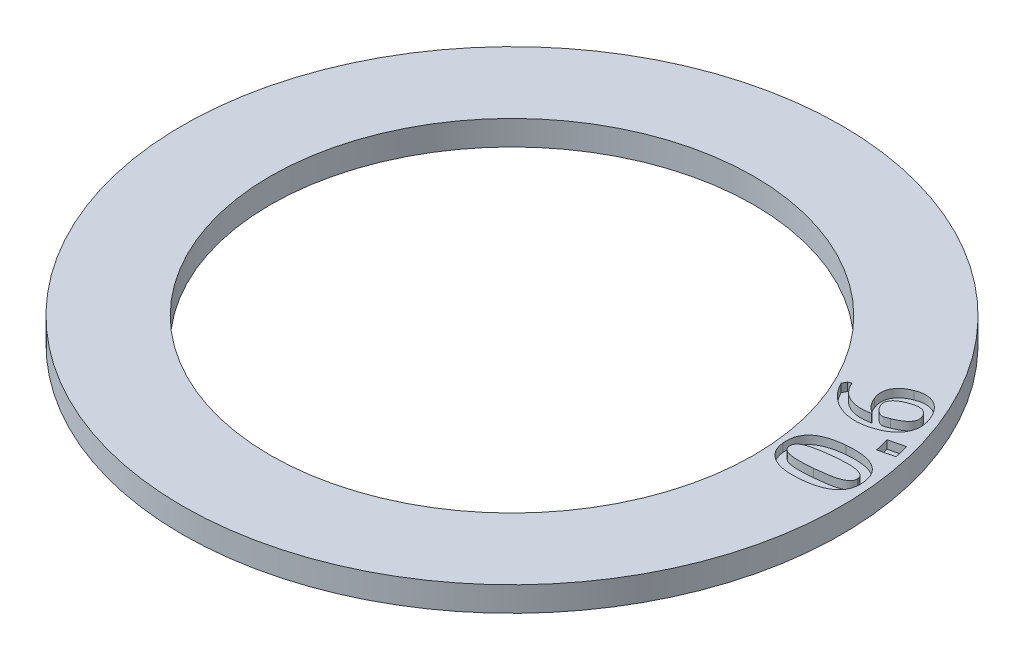
from build123d import *

# Parameters (mm, degrees)
SKETCH1_R           = 8.001
BOSS_EXTRUDE1_DEPTH = 0.6
SKETCH2_R           = 5.8674
CUT_EXTRUDE1_DEPTH  = 12.33101946
CUT_EXTRUDE2_DEPTH  = 0.2


with BuildPart() as part:
    # Sketch1 → Boss-Extrude1 (new body)
    with BuildSketch(Plane(origin=(0, 0, 0), x_dir=(1, 0, 0), z_dir=(0, 1, 0))):
        with Locations(Location((0, 0, 0), (0, 0, 270))):
            Circle(SKETCH1_R)
    extrude(amount=BOSS_EXTRUDE1_DEPTH)

    # Sketch2 → Cut-Extrude1 (cut, through all)
    with BuildSketch(Plane(origin=(0, 0, 0), x_dir=(-1, 0, 0), z_dir=(0, -1, 0))):
        with Locations(Location((0, 0, 0), (0, 0, 90))):
            Circle(SKETCH2_R)
    extrude(amount=-CUT_EXTRUDE1_DEPTH, mode=Mode.SUBTRACT)

    # Sketch4 → Cut-Extrude2 (cut)
    # profile 1 of 3: a face of its own
    with BuildSketch(Plane(origin=(0, 0.6, 0), x_dir=(1, 0, 0), z_dir=(0, 1, 0))):
        with BuildLine():
            add(Edge.make_bspline(
                [(7.767246669, 0.768228733), (7.768616681, 0.751777921), (7.771299992, 0.719557319), (7.771651226, 0.671847724), (7.768847829, 0.625994497), (7.763791281, 0.581665493), (7.754525531, 0.539395414), (7.743704494, 0.498411153), (7.728767986, 0.459603516), (7.711597242, 0.422178612), (7.690346507, 0.38684131), (7.666177088, 0.352853357), (7.638236216, 0.320709452), (7.606549541, 0.290467202), (7.571549975, 0.261408498), (7.532380513, 0.234700263), (7.490118852, 0.208976421), (7.444215831, 0.185169051), (7.394617995, 0.163124569), (7.341151112, 0.143032403), (7.283774168, 0.125099553), (7.22262746, 0.108861729), (7.15773129, 0.094649482), (7.088990392, 0.082380601), (7.016411757, 0.071901926), (6.966626953, 0.066709436), (6.941140332, 0.064051215)],
                knots=[0, 0, 0, 0, 0.959744186, 1.879757445, 2.771360733, 3.630433483, 4.470974874, 5.285729423, 6.092861057, 6.885868194, 7.677321799, 8.486806591, 9.30863703, 10.149710703, 11.031725224, 11.950856355, 12.90393232, 13.90755666, 14.955572763, 16.058595042, 17.227175211, 18.449982035, 19.736657795, 21.08935819, 22.509938377, 24, 24, 24, 24], degree=3))
            add(Edge.make_bspline(
                [(6.941140332, 0.064051215), (6.916974995, 0.061880059), (6.869600459, 0.057623652), (6.799552695, 0.05546182), (6.732246619, 0.054095152), (6.667515752, 0.056808837), (6.605390434, 0.060933713), (6.545892766, 0.069167948), (6.488793375, 0.078192436), (6.434684358, 0.091290062), (6.383159339, 0.106087129), (6.334547992, 0.124016841), (6.288435008, 0.14379007), (6.245679424, 0.166919217), (6.205071209, 0.191290458), (6.168116215, 0.219405569), (6.133618735, 0.249507551), (6.101916714, 0.281940861), (6.073178989, 0.316655739), (6.048138911, 0.354096013), (6.025624552, 0.393275429), (6.006775454, 0.434830179), (5.990860649, 0.478280184), (5.97804857, 0.523914814), (5.968933769, 0.571851451), (5.965003292, 0.604601182), (5.963008821, 0.621219618)],
                knots=[0, 0, 0, 0, 1.373964495, 2.693565985, 3.968553968, 5.185962309, 6.362128109, 7.493465967, 8.586945452, 9.634820339, 10.644545933, 11.621736809, 12.567827687, 13.483617295, 14.373243629, 15.247464012, 16.109610849, 16.964804151, 17.813643683, 18.658252232, 19.51307309, 20.370435758, 21.2393278, 22.1319618, 23.052087694, 24, 24, 24, 24], degree=3))
            add(Edge.make_bspline(
                [(5.963008821, 0.621219618), (5.961184373, 0.646930902), (5.95763602, 0.696936533), (5.96137283, 0.770131508), (5.971504627, 0.839027769), (5.989228129, 0.903508083), (6.014520014, 0.96357217), (6.04714147, 1.019062788), (6.086958764, 1.070172135), (6.134139349, 1.116694144), (6.188721214, 1.159142499), (6.251133852, 1.196622046), (6.320892733, 1.230357684), (6.39805777, 1.259957356), (6.483198664, 1.284783723), (6.575549001, 1.305930912), (6.675709611, 1.322447947), (6.745085036, 1.329983457), (6.781012294, 1.333885851)],
                knots=[0, 0, 0, 0, 0.999181933, 1.943299396, 2.836688392, 3.696188225, 4.530240668, 5.35776012, 6.186181664, 7.036493394, 7.921805995, 8.862264049, 9.85532249, 10.92466266, 12.06451709, 13.293082439, 14.598176172, 16, 16, 16, 16], degree=3))
            add(Edge.make_bspline(
                [(6.781012294, 1.333885851), (6.81803141, 1.33685429), (6.8896785, 1.34259943), (6.994289887, 1.344482115), (7.09247788, 1.340834394), (7.184314819, 1.331440489), (7.269728355, 1.316028511), (7.348801983, 1.295144467), (7.421216007, 1.267592042), (7.487377583, 1.234868523), (7.546865181, 1.196208576), (7.599372849, 1.151568024), (7.644857911, 1.101265586), (7.683986055, 1.045789028), (7.715146063, 0.984112878), (7.739851728, 0.917186349), (7.758380239, 0.84479307), (7.764241211, 0.794181785), (7.767246669, 0.768228733)],
                knots=[0, 0, 0, 0, 1.381791394, 2.674330027, 3.891007168, 5.036428095, 6.106690612, 7.117972597, 8.075364145, 8.985087285, 9.859944246, 10.708764313, 11.542333244, 12.37753583, 13.227367402, 14.105765436, 15.028652003, 16, 16, 16, 16], degree=3))
        make_face()
        with BuildLine():
            add(Edge.make_bspline(
                [(6.866671148, 0.452602865), (6.889697586, 0.454875299), (6.934491251, 0.4592959), (6.999872995, 0.466462648), (7.061538367, 0.47487975), (7.1196573, 0.482517183), (7.173836485, 0.491793094), (7.224500186, 0.500320864), (7.271415228, 0.510077719), (7.314968307, 0.519989326), (7.355047115, 0.530925535), (7.392230977, 0.54188216), (7.426327762, 0.554128369), (7.45792115, 0.566154622), (7.486549911, 0.579270405), (7.512216891, 0.59318471), (7.534954055, 0.607890264), (7.561267422, 0.627278523), (7.588091481, 0.654296895), (7.610574076, 0.691529303), (7.622579768, 0.732786526), (7.621540687, 0.76108619), (7.621009255, 0.775559896)],
                knots=[0, 0, 0, 0, 1.559939649, 3.034573339, 4.433834629, 5.755759396, 6.985974602, 8.139252337, 9.219098498, 10.216076828, 11.149973839, 12.019543174, 12.828554085, 13.591800542, 14.297942877, 14.949827997, 15.558345547, 16.121961591, 17.152098737, 18.100852136, 19.028691373, 20, 20, 20, 20], degree=3))
            add(Edge.make_bspline(
                [(7.621009255, 0.775559896), (7.619926587, 0.783444862), (7.617802115, 0.798917181), (7.611247364, 0.820913825), (7.601815494, 0.841113003), (7.589289355, 0.85946844), (7.573504688, 0.876151112), (7.554876253, 0.891806256), (7.532589397, 0.905483149), (7.507224363, 0.918389587), (7.478179436, 0.929907602), (7.445133323, 0.939893447), (7.407985388, 0.948278178), (7.366622767, 0.955112177), (7.320673845, 0.960565141), (7.26993871, 0.963996795), (7.214067393, 0.964849171), (7.153475824, 0.96443608), (7.088620395, 0.962639875), (7.020087861, 0.958426726), (6.948029164, 0.953644299), (6.898817126, 0.949169218), (6.87361646, 0.946877604)],
                knots=[0, 0, 0, 0, 0.573306212, 1.12497326, 1.647738541, 2.175091007, 2.719775143, 3.2992746, 3.924540973, 4.60063781, 5.349821626, 6.17422386, 7.087672211, 8.09400518, 9.19609116, 10.423188986, 11.759030231, 13.224456304, 14.792560164, 16.436793354, 18.175341204, 20, 20, 20, 20], degree=3))
            add(Edge.make_bspline(
                [(6.87361646, 0.946877604), (6.836687451, 0.943168116), (6.765837033, 0.936051252), (6.6642894, 0.923461037), (6.572167603, 0.909249697), (6.489397948, 0.893929398), (6.415975648, 0.877516996), (6.351671393, 0.859878624), (6.296531315, 0.841328265), (6.250231831, 0.821497208), (6.211722069, 0.800868735), (6.179827667, 0.779476626), (6.154312053, 0.756843646), (6.134327243, 0.733560472), (6.120632252, 0.708587263), (6.111522689, 0.682666394), (6.107088612, 0.655184126), (6.108005916, 0.636534703), (6.108474533, 0.627007378)],
                knots=[0, 0, 0, 0, 1.987774042, 3.813658246, 5.479624312, 6.979295976, 8.321212524, 9.507797241, 10.549079436, 11.434594746, 12.202068828, 12.886080949, 13.486172645, 14.024182533, 14.520633445, 15.002090577, 15.490203663, 16, 16, 16, 16], degree=3))
            add(Edge.make_bspline(
                [(6.108474533, 0.627007378), (6.109977202, 0.616105411), (6.112912381, 0.594810466), (6.124504195, 0.564901982), (6.141393458, 0.538156965), (6.163940725, 0.514563755), (6.192219175, 0.494509046), (6.225899733, 0.477658199), (6.264821299, 0.46332312), (6.309515168, 0.452424457), (6.359718904, 0.44419951), (6.415351194, 0.438023841), (6.476531013, 0.434692049), (6.543336384, 0.434110018), (6.615897868, 0.435798603), (6.694364654, 0.439369725), (6.778648309, 0.444614762), (6.836714922, 0.449884327), (6.866671148, 0.452602865)],
                knots=[0, 0, 0, 0, 0.622531695, 1.215998619, 1.802972471, 2.4067536, 3.054715399, 3.759494987, 4.537400922, 5.402670149, 6.364594255, 7.421637757, 8.576224243, 9.838461732, 11.210360544, 12.692839009, 14.293854979, 16, 16, 16, 16], degree=3))
        make_face(mode=Mode.SUBTRACT)
    # profile 2 of 3: a face of its own
    with BuildSketch(Plane(origin=(0, 0.6, 0), x_dir=(1, 0, 0), z_dir=(0, 1, 0))):
        Polygon((7.162360941, 1.945434774), (7.54473898, 2.039196493), (7.62846858, 1.69849033), (7.246090542, 1.604728611), align=None)
    # profile 3 of 3: a face of its own
    with BuildSketch(Plane(origin=(0, 0.6, 0), x_dir=(1, 0, 0), z_dir=(0, 1, 0))):
        with BuildLine():
            Line((5.469586331, 2.679067715), (5.544441366, 2.709164069))
            add(Edge.make_bspline(
                [(5.544441366, 2.709164069), (5.553997437, 2.688026155), (5.57271904, 2.646614199), (5.606167014, 2.588592367), (5.642814457, 2.535425732), (5.683122205, 2.487380335), (5.726749434, 2.444088965), (5.774653894, 2.406794612), (5.825317941, 2.37360927), (5.879587149, 2.345906768), (5.936871534, 2.322937923), (5.997312638, 2.30574494), (6.060554964, 2.293371391), (6.126627308, 2.286027104), (6.195527294, 2.284304113), (6.267185278, 2.28753626), (6.341706905, 2.295527879), (6.391948354, 2.30472372), (6.417621487, 2.309422749)],
                knots=[0, 0, 0, 0, 1.056358198, 2.069544787, 3.046463473, 3.994810355, 4.922992523, 5.840907532, 6.755975124, 7.67847983, 8.612102683, 9.563504181, 10.536884028, 11.545076423, 12.588532476, 13.673608831, 14.811225531, 16, 16, 16, 16], degree=3))
            Line((6.417621487, 2.309422749), (6.418007338, 2.323313374))
            add(Edge.make_bspline(
                [(6.418007338, 2.323313374), (6.401355529, 2.334631587), (6.368597807, 2.35689697), (6.323634535, 2.394045133), (6.282807557, 2.432896767), (6.245644899, 2.473597232), (6.212557562, 2.51772228), (6.183001039, 2.56541758), (6.155666828, 2.616491824), (6.140307212, 2.652572924), (6.132477824, 2.67096485)],
                knots=[0, 0, 0, 0, 1.055747646, 2.076884814, 3.055218345, 4.010598299, 4.964643125, 5.943744131, 6.951847215, 8, 8, 8, 8], degree=3))
            add(Edge.make_bspline(
                [(6.132477824, 2.67096485), (6.124144285, 2.693542686), (6.107940409, 2.737443416), (6.094488788, 2.804658259), (6.090399573, 2.869977809), (6.095698921, 2.933219735), (6.110473661, 2.993848126), (6.134162603, 3.051201513), (6.16720264, 3.104558434), (6.208469463, 3.154168147), (6.257665276, 3.199583358), (6.314070539, 3.240569597), (6.377451954, 3.277200054), (6.423313951, 3.297019764), (6.44694614, 3.307232645)],
                knots=[0, 0, 0, 0, 1.077155339, 2.094439236, 3.058665492, 4.001572549, 4.926966633, 5.844248602, 6.77044999, 7.728299098, 8.727445613, 9.762645402, 10.84711545, 12, 12, 12, 12], degree=3))
            add(Edge.make_bspline(
                [(6.44694614, 3.307232645), (6.473236176, 3.316913762), (6.524481937, 3.335784645), (6.60329955, 3.35217586), (6.68053309, 3.359268693), (6.744027272, 3.35567564), (6.793453122, 3.347421792), (6.829915938, 3.338655382), (6.86541622, 3.326474087), (6.900467983, 3.311974761), (6.93427802, 3.293545595), (6.96769255, 3.272764426), (6.999992534, 3.248650775), (7.03180405, 3.222110008), (7.062183409, 3.192269), (7.091526882, 3.159777486), (7.119852526, 3.124645406), (7.14635736, 3.086373409), (7.171510158, 3.045228596), (7.195374834, 3.001333961), (7.217765588, 2.954520291), (7.231387248, 2.922084415), (7.238325914, 2.905562072)],
                knots=[0, 0, 0, 0, 1.667556463, 3.25047863, 4.781272758, 6.278229574, 7.024172525, 7.765890255, 8.509980223, 9.258752894, 10.023401272, 10.801717744, 11.60191677, 12.423308393, 13.268840413, 14.13706473, 15.031221836, 15.956122909, 16.909146299, 17.903763151, 18.93220877, 20, 20, 20, 20], degree=3))
            add(Edge.make_bspline(
                [(7.238325914, 2.905562072), (7.2443027, 2.890195718), (7.256091154, 2.85988753), (7.270206202, 2.814079535), (7.281447749, 2.768983073), (7.290206517, 2.724734428), (7.295035445, 2.680969441), (7.297366888, 2.637949102), (7.297303475, 2.59562517), (7.293087891, 2.554150621), (7.286909194, 2.51353294), (7.276525462, 2.474053444), (7.263865247, 2.435486591), (7.248514728, 2.397763276), (7.229434766, 2.361476988), (7.207358901, 2.32636834), (7.182490078, 2.292198488), (7.154841885, 2.259129557), (7.124091062, 2.227362722), (7.09069323, 2.196764846), (7.053745523, 2.168499399), (7.014632721, 2.140855319), (6.972678054, 2.11451325), (6.92727904, 2.090508071), (6.879547835, 2.067119037), (6.846252108, 2.053298895), (6.829324178, 2.046272576)],
                knots=[0, 0, 0, 0, 1.096611481, 2.162927238, 3.186037776, 4.187888433, 5.161159185, 6.112325853, 7.053588294, 7.973131817, 8.883271785, 9.783950666, 10.684995271, 11.582783765, 12.489821363, 13.408608175, 14.339664491, 15.299375374, 16.273661144, 17.279195558, 18.309579485, 19.365961692, 20.46524052, 21.602267724, 22.780965421, 24, 24, 24, 24], degree=3))
            add(Edge.make_bspline(
                [(6.829324178, 2.046272576), (6.80588988, 2.03723599), (6.759598052, 2.01938523), (6.689016712, 1.997912732), (6.618825108, 1.980512848), (6.548906421, 1.967215564), (6.479160521, 1.95877988), (6.409586295, 1.954530061), (6.340114182, 1.954388304), (6.27104884, 1.959161531), (6.202978844, 1.967880027), (6.136231824, 1.981133483), (6.071094525, 1.998378194), (6.007448873, 2.020161649), (5.945419807, 2.04611896), (5.884556954, 2.075616728), (5.825805484, 2.110414242), (5.76844495, 2.148723184), (5.713505797, 2.191118244), (5.661157094, 2.236700271), (5.612181483, 2.285817879), (5.56608196, 2.338158263), (5.522763256, 2.393724009), (5.482764379, 2.452874701), (5.445465095, 2.51500698), (5.423535077, 2.558410676), (5.412480428, 2.580289937)],
                knots=[0, 0, 0, 0, 1.077130003, 2.127749498, 3.16214838, 4.178257318, 5.178772943, 6.173750996, 7.16687633, 8.156701088, 9.141484692, 10.108834361, 11.073757893, 12.029902727, 12.99204604, 13.956843372, 14.928666993, 15.918737754, 16.914144044, 17.903415071, 18.894361722, 19.887272469, 20.893794336, 21.914506485, 22.948728778, 24, 24, 24, 24], degree=3))
            Line((5.412480428, 2.580289937), (5.469586331, 2.679067715))
        make_face()
        with BuildLine():
            add(Edge.make_bspline(
                [(6.355885376, 2.595723965), (6.364392974, 2.576860574), (6.381105581, 2.539804702), (6.416315425, 2.491135286), (6.456770828, 2.450633633), (6.493640113, 2.423674865), (6.52241325, 2.406783239), (6.541257245, 2.396937822), (6.557278622, 2.389536789), (6.576012417, 2.382703034), (6.601726821, 2.38085922), (6.629674718, 2.385291164), (6.657594919, 2.392768549), (6.685657011, 2.402311902), (6.720184627, 2.41465017), (6.745109464, 2.424456078), (6.758713501, 2.429808166)],
                knots=[0, 0, 0, 0, 1.715188831, 3.369373986, 4.955727778, 6.453567762, 7.1479668, 7.72613665, 8.218601481, 8.61387478, 9.376049685, 10.32485958, 10.954526185, 11.775455388, 12.785838147, 14, 14, 14, 14], degree=3))
            add(Edge.make_bspline(
                [(6.758713501, 2.429808166), (6.776544794, 2.437080849), (6.810999921, 2.451133739), (6.85972962, 2.474599387), (6.904497164, 2.497960261), (6.945233872, 2.52179449), (6.981523303, 2.546500298), (7.013701419, 2.571549843), (7.041767959, 2.597038569), (7.065572981, 2.62331801), (7.08484524, 2.650526758), (7.100772273, 2.677928422), (7.111539793, 2.706383316), (7.118305122, 2.73532386), (7.120562501, 2.764971632), (7.118649119, 2.795389541), (7.111921342, 2.82634549), (7.104667825, 2.846599886), (7.100963067, 2.856944885)],
                knots=[0, 0, 0, 0, 1.502934363, 2.90409636, 4.21996375, 5.444239781, 6.585990555, 7.644448635, 8.625095522, 9.542269315, 10.405952225, 11.224144183, 12.009136967, 12.771458386, 13.536880965, 14.321616879, 15.142760389, 16, 16, 16, 16], degree=3))
            add(Edge.make_bspline(
                [(7.100963067, 2.856944885), (7.096120891, 2.868417557), (7.086759812, 2.890596963), (7.068273066, 2.920239485), (7.048438606, 2.946389698), (7.025073799, 2.967205053), (7.000457786, 2.984802784), (6.973589026, 2.998420683), (6.945160529, 3.008970773), (6.914589834, 3.015349868), (6.882540547, 3.018765885), (6.848672177, 3.019219168), (6.813224486, 3.015806918), (6.762647789, 3.007919282), (6.695831451, 2.990711885), (6.643160538, 2.970790797), (6.615562894, 2.960352871)],
                knots=[0, 0, 0, 0, 0.925741845, 1.78967934, 2.5943642, 3.360334015, 4.109597676, 4.842024583, 5.596411891, 6.360943489, 7.160482887, 7.9937254, 8.878122023, 9.808656522, 11.803888333, 14, 14, 14, 14], degree=3))
            add(Edge.make_bspline(
                [(6.615562894, 2.960352871), (6.601747555, 2.954559261), (6.57488151, 2.943292699), (6.536683031, 2.924878763), (6.501957444, 2.905393917), (6.469992057, 2.886018902), (6.442003784, 2.865031519), (6.416819586, 2.843919605), (6.395752541, 2.821331761), (6.377281822, 2.798636053), (6.362542258, 2.775018975), (6.351351528, 2.750864084), (6.342793598, 2.726388199), (6.338892465, 2.701084601), (6.337377791, 2.675278034), (6.340507573, 2.64900601), (6.346063883, 2.622114236), (6.352560802, 2.604657068), (6.355885376, 2.595723965)],
                knots=[0, 0, 0, 0, 1.42442202, 2.770007142, 4.029169443, 5.210178423, 6.320692607, 7.352739124, 8.330303178, 9.252842556, 10.131792095, 10.968904114, 11.781076229, 12.587333494, 13.395351248, 14.231390505, 15.09497516, 16, 16, 16, 16], degree=3))
        make_face(mode=Mode.SUBTRACT)
    extrude(amount=-CUT_EXTRUDE2_DEPTH, mode=Mode.SUBTRACT)


solid = part.part
